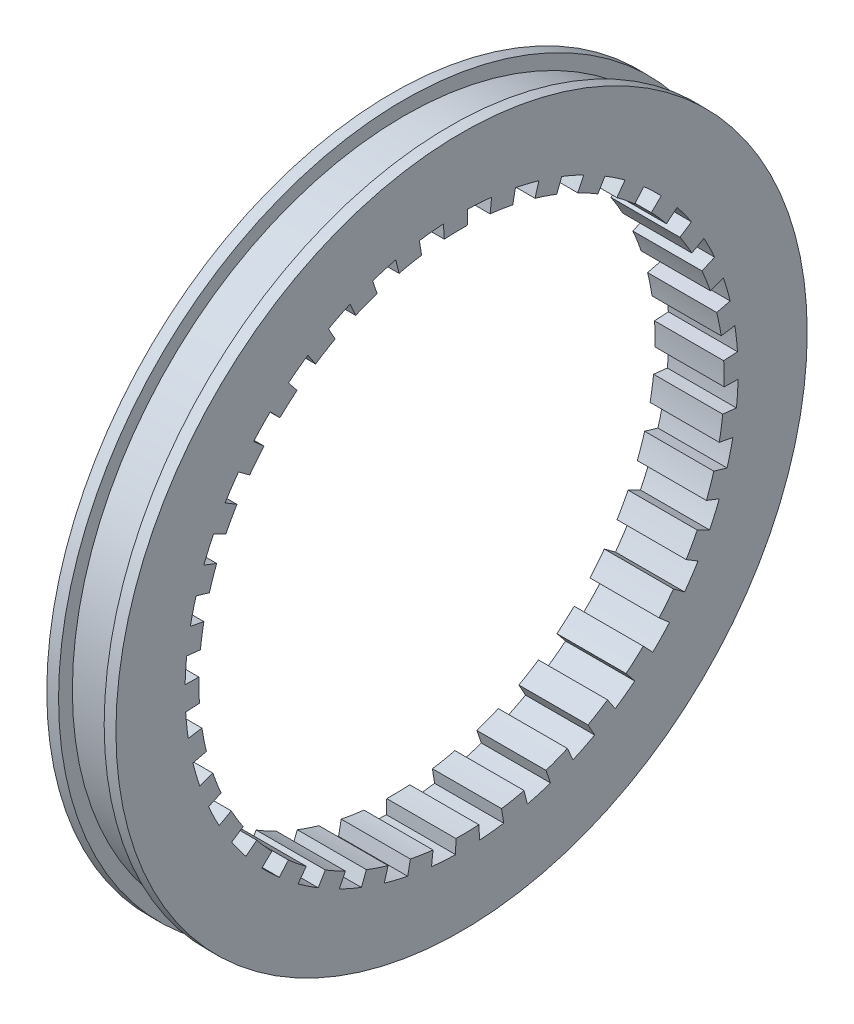
from build123d import *

# Parameters (mm, degrees)
SKETCH1_R               = 20
BOSS_EXTRUDE1_DEPTH     = 4
CUT_EXTRUDE1_DEPTH      = 29.565713714
CIRPATTERN2_COUNT       = 36
SKETCH5_R               = 25
BOSS_EXTRUDE2_DEPTH     = 5
CUT_EXTRUDE2_DEPTH      = 37.482872694
CUT_EXTRUDE2_DEPTH_BACK = 37.482872694
SKETCH7_W               = 3.3
SKETCH7_H               = 2
SCALE1_SCALE            = 1.9329
SCALE2_SCALE            = 1.5


with BuildPart() as part:
    # Sketch1 → Boss-Extrude1 (new body)
    with BuildSketch(Plane(origin=(0, 0, 0), x_dir=(0, 0, -1), z_dir=(1, 0, 0))):
        Circle(SKETCH1_R)
    extrude(amount=BOSS_EXTRUDE1_DEPTH)

    # Sketch2 → Cut-Extrude1 (cut, through all)
    with BuildSketch(Plane(origin=(4, 0, 0), x_dir=(0, 0, -1), z_dir=(1, 0, 0))):
        with BuildLine():
            Line((-17.042306621, 8.399987204), (-17.939270128, 8.842091794))
            ThreePointArc((-17.939270128, 8.842091794), (-17.53650929, 9.616176054), (-17.100366711, 10.371955377))
            Line((-17.100366711, 10.371955377), (-16.245348375, 9.853357608))
            ThreePointArc((-16.245348375, 9.853357608), (-16.659683826, 9.135367252), (-17.042306621, 8.399987204))
        make_face()
    cut_extrude1 = extrude(amount=-CUT_EXTRUDE1_DEPTH, mode=Mode.SUBTRACT)

    # CirPattern2: Cut-Extrude1 ×36 about axis
    cirpattern2_axis = Axis((0, 0, 0), (1, 0, 0))
    for i in range(1, CIRPATTERN2_COUNT):
        add(cut_extrude1.rotate(cirpattern2_axis, i * 360 / CIRPATTERN2_COUNT), mode=Mode.SUBTRACT)

    # Sketch6 → Cut-Extrude2 (cut, two sides: drawn at the far end of the back side and taken through both)
    with BuildSketch(Plane(origin=(9, 0, 0), x_dir=(0, 0, -1), z_dir=(1, 0, 0)).offset(-CUT_EXTRUDE2_DEPTH_BACK)):
        with BuildLine():
            Line((-10.559076871, 15.795755621), (-11.114817759, 16.62711118))
            ThreePointArc((-11.114817759, 16.62711118), (-11.829503319, 16.126464313), (-12.521670746, 15.595119805))
            Line((-12.521670746, 15.595119805), (-11.895587209, 14.815363814))
            ThreePointArc((-11.895587209, 14.815363814), (-12.530502339, 14.282384644), (-13.141564946, 13.722218144))
            Line((-13.141564946, 13.722218144), (-13.833226259, 14.444440151))
            ThreePointArc((-13.833226259, 14.444440151), (-14.450117723, 13.82729539), (-15.039502566, 13.183829586))
            Line((-15.039502566, 13.183829586), (-14.287527438, 12.524638107))
            ThreePointArc((-14.287527438, 12.524638107), (-14.820245919, 11.889504233), (-15.324753219, 11.231738012))
            Line((-15.324753219, 11.231738012), (-16.131319178, 11.822882118))
            ThreePointArc((-16.131319178, 11.822882118), (-16.631672612, 11.107991094), (-17.100366711, 10.371955377))
            Line((-17.100366711, 10.371955377), (-16.245348375, 9.853357608))
            ThreePointArc((-16.245348375, 9.853357608), (-16.659683826, 9.135367252), (-17.042306621, 8.399987204))
            Line((-17.042306621, 8.399987204), (-17.939270128, 8.842091794))
            ThreePointArc((-17.939270128, 8.842091794), (-18.307882545, 8.051176109), (-18.641644866, 7.244934553))
            Line((-18.641644866, 7.244934553), (-17.709562623, 6.882687825))
            ThreePointArc((-17.709562623, 6.882687825), (-17.99292567, 6.103656759), (-18.24203816, 5.313007036))
            Line((-18.24203816, 5.313007036), (-19.202145432, 5.592638985))
            ThreePointArc((-19.202145432, 5.592638985), (-19.42781673, 4.749730212), (-19.616506076, 3.897780058))
            Line((-19.616506076, 3.897780058), (-18.635680772, 3.702891055))
            ThreePointArc((-18.635680772, 3.702891055), (-18.779461573, 2.886489745), (-18.887494601, 2.064593837))
            Line((-18.887494601, 2.064593837), (-19.881573264, 2.173256671))
            ThreePointArc((-19.881573264, 2.173256671), (-19.957446536, 1.303966166), (-19.995329674, 0.432193488))
            Line((-19.995329674, 0.432193488), (-18.995563191, 0.410583814))
            ThreePointArc((-18.995563191, 0.410583814), (-18.995393038, -0.4183818), (-18.959064075, -1.246551))
            Line((-18.959064075, -1.246551), (-19.956909553, -1.312158948))
            ThreePointArc((-19.956909553, -1.312158948), (-19.880679427, -2.181418232), (-19.766605299, -3.046525062))
            Line((-19.766605299, -3.046525062), (-18.778275034, -2.894198809))
            ThreePointArc((-18.778275034, -2.894198809), (-18.634159098, -3.710541026), (-18.454571981, -4.519820017))
            Line((-18.454571981, -4.519820017), (-19.425865244, -4.757705281))
            ThreePointArc((-19.425865244, -4.757705281), (-19.199847935, -5.60052134), (-18.937282624, -6.43267649))
            Line((-18.937282624, -6.43267649), (-17.990418493, -6.111042665))
            ThreePointArc((-17.990418493, -6.111042665), (-17.706735664, -6.88995734), (-17.389347057, -7.655756589))
            Line((-17.389347057, -7.655756589), (-18.304575849, -8.058691146))
            ThreePointArc((-18.304575849, -8.058691146), (-17.935638778, -8.849455442), (-17.532560199, -9.623374297))
            Line((-17.532560199, -9.623374297), (-16.655932189, -9.142205582))
            ThreePointArc((-16.655932189, -9.142205582), (-16.241302026, -9.860025786), (-15.795755621, -10.559076871))
            Line((-15.795755621, -10.559076871), (-16.62711118, -11.114817759))
            ThreePointArc((-16.62711118, -11.114817759), (-16.126464313, -11.829503319), (-15.595119805, -12.521670746))
            Line((-15.595119805, -12.521670746), (-14.815363814, -11.895587209))
            ThreePointArc((-14.815363814, -11.895587209), (-14.282384644, -12.530502339), (-13.722218144, -13.141564946))
            Line((-13.722218144, -13.141564946), (-14.444440151, -13.833226259))
            ThreePointArc((-14.444440151, -13.833226259), (-13.82729539, -14.450117723), (-13.183829586, -15.039502566))
            Line((-13.183829586, -15.039502566), (-12.524638107, -14.287527438))
            ThreePointArc((-12.524638107, -14.287527438), (-11.889504233, -14.820245919), (-11.231738012, -15.324753219))
            Line((-11.231738012, -15.324753219), (-11.822882118, -16.131319178))
            ThreePointArc((-11.822882118, -16.131319178), (-11.107991094, -16.631672612), (-10.371955377, -17.100366711))
            Line((-10.371955377, -17.100366711), (-9.853357608, -16.245348375))
            ThreePointArc((-9.853357608, -16.245348375), (-9.135367252, -16.659683826), (-8.399987204, -17.042306621))
            Line((-8.399987204, -17.042306621), (-8.842091794, -17.939270128))
            ThreePointArc((-8.842091794, -17.939270128), (-8.051176109, -18.307882545), (-7.244934553, -18.641644866))
            Line((-7.244934553, -18.641644866), (-6.882687825, -17.709562623))
            ThreePointArc((-6.882687825, -17.709562623), (-6.103656759, -17.99292567), (-5.313007036, -18.24203816))
            Line((-5.313007036, -18.24203816), (-5.592638985, -19.202145432))
            ThreePointArc((-5.592638985, -19.202145432), (-4.749730212, -19.42781673), (-3.897780058, -19.616506076))
            Line((-3.897780058, -19.616506076), (-3.702891055, -18.635680772))
            ThreePointArc((-3.702891055, -18.635680772), (-2.886489745, -18.779461573), (-2.064593837, -18.887494601))
            Line((-2.064593837, -18.887494601), (-2.173256671, -19.881573264))
            ThreePointArc((-2.173256671, -19.881573264), (-1.303966166, -19.957446536), (-0.432193488, -19.995329674))
            Line((-0.432193488, -19.995329674), (-0.410583814, -18.995563191))
            ThreePointArc((-0.410583814, -18.995563191), (0.4183818, -18.995393038), (1.246551, -18.959064075))
            Line((1.246551, -18.959064075), (1.312158948, -19.956909553))
            ThreePointArc((1.312158948, -19.956909553), (2.181418232, -19.880679427), (3.046525062, -19.766605299))
            Line((3.046525062, -19.766605299), (2.894198809, -18.778275034))
            ThreePointArc((2.894198809, -18.778275034), (3.710541026, -18.634159098), (4.519820017, -18.454571981))
            Line((4.519820017, -18.454571981), (4.757705281, -19.425865244))
            ThreePointArc((4.757705281, -19.425865244), (5.60052134, -19.199847935), (6.43267649, -18.937282624))
            Line((6.43267649, -18.937282624), (6.111042665, -17.990418493))
            ThreePointArc((6.111042665, -17.990418493), (6.88995734, -17.706735664), (7.655756589, -17.389347057))
            Line((7.655756589, -17.389347057), (8.058691146, -18.304575849))
            ThreePointArc((8.058691146, -18.304575849), (8.849455442, -17.935638778), (9.623374297, -17.532560199))
            Line((9.623374297, -17.532560199), (9.142205582, -16.655932189))
            ThreePointArc((9.142205582, -16.655932189), (9.860025786, -16.241302026), (10.559076871, -15.795755621))
            Line((10.559076871, -15.795755621), (11.114817759, -16.62711118))
            ThreePointArc((11.114817759, -16.62711118), (11.829503319, -16.126464313), (12.521670746, -15.595119805))
            Line((12.521670746, -15.595119805), (11.895587209, -14.815363814))
            ThreePointArc((11.895587209, -14.815363814), (12.530502339, -14.282384644), (13.141564946, -13.722218144))
            Line((13.141564946, -13.722218144), (13.833226259, -14.444440151))
            ThreePointArc((13.833226259, -14.444440151), (14.450117723, -13.82729539), (15.039502566, -13.183829586))
            Line((15.039502566, -13.183829586), (14.287527438, -12.524638107))
            ThreePointArc((14.287527438, -12.524638107), (14.820245919, -11.889504233), (15.324753219, -11.231738012))
            Line((15.324753219, -11.231738012), (16.131319178, -11.822882118))
            ThreePointArc((16.131319178, -11.822882118), (16.631672612, -11.107991094), (17.100366711, -10.371955377))
            Line((17.100366711, -10.371955377), (16.245348375, -9.853357608))
            ThreePointArc((16.245348375, -9.853357608), (16.659683826, -9.135367252), (17.042306621, -8.399987204))
            Line((17.042306621, -8.399987204), (17.939270128, -8.842091794))
            ThreePointArc((17.939270128, -8.842091794), (18.307882545, -8.051176109), (18.641644866, -7.244934553))
            Line((18.641644866, -7.244934553), (17.709562623, -6.882687825))
            ThreePointArc((17.709562623, -6.882687825), (17.99292567, -6.103656759), (18.24203816, -5.313007036))
            Line((18.24203816, -5.313007036), (19.202145432, -5.592638985))
            ThreePointArc((19.202145432, -5.592638985), (19.42781673, -4.749730212), (19.616506076, -3.897780058))
            Line((19.616506076, -3.897780058), (18.635680772, -3.702891055))
            ThreePointArc((18.635680772, -3.702891055), (18.779461573, -2.886489745), (18.887494601, -2.064593837))
            Line((18.887494601, -2.064593837), (19.881573264, -2.173256671))
            ThreePointArc((19.881573264, -2.173256671), (19.957446536, -1.303966166), (19.995329674, -0.432193488))
            Line((19.995329674, -0.432193488), (18.995563191, -0.410583814))
            ThreePointArc((18.995563191, -0.410583814), (18.995393038, 0.4183818), (18.959064075, 1.246551))
            Line((18.959064075, 1.246551), (19.956909553, 1.312158948))
            ThreePointArc((19.956909553, 1.312158948), (19.880679427, 2.181418232), (19.766605299, 3.046525062))
            Line((19.766605299, 3.046525062), (18.778275034, 2.894198809))
            ThreePointArc((18.778275034, 2.894198809), (18.634159098, 3.710541026), (18.454571981, 4.519820017))
            Line((18.454571981, 4.519820017), (19.425865244, 4.757705281))
            ThreePointArc((19.425865244, 4.757705281), (19.199847935, 5.60052134), (18.937282624, 6.43267649))
            Line((18.937282624, 6.43267649), (17.990418493, 6.111042665))
            ThreePointArc((17.990418493, 6.111042665), (17.706735664, 6.88995734), (17.389347057, 7.655756589))
            Line((17.389347057, 7.655756589), (18.304575849, 8.058691146))
            ThreePointArc((18.304575849, 8.058691146), (17.935638778, 8.849455442), (17.532560199, 9.623374297))
            Line((17.532560199, 9.623374297), (16.655932189, 9.142205582))
            ThreePointArc((16.655932189, 9.142205582), (16.241302026, 9.860025786), (15.795755621, 10.559076871))
            Line((15.795755621, 10.559076871), (16.62711118, 11.114817759))
            ThreePointArc((16.62711118, 11.114817759), (16.126464313, 11.829503319), (15.595119805, 12.521670746))
            Line((15.595119805, 12.521670746), (14.815363814, 11.895587209))
            ThreePointArc((14.815363814, 11.895587209), (14.282384644, 12.530502339), (13.722218144, 13.141564946))
            Line((13.722218144, 13.141564946), (14.444440151, 13.833226259))
            ThreePointArc((14.444440151, 13.833226259), (13.82729539, 14.450117723), (13.183829586, 15.039502566))
            Line((13.183829586, 15.039502566), (12.524638107, 14.287527438))
            ThreePointArc((12.524638107, 14.287527438), (11.889504233, 14.820245919), (11.231738012, 15.324753219))
            Line((11.231738012, 15.324753219), (11.822882118, 16.131319178))
            ThreePointArc((11.822882118, 16.131319178), (11.107991094, 16.631672612), (10.371955377, 17.100366711))
            Line((10.371955377, 17.100366711), (9.853357608, 16.245348375))
            ThreePointArc((9.853357608, 16.245348375), (9.135367252, 16.659683826), (8.399987204, 17.042306621))
            Line((8.399987204, 17.042306621), (8.842091794, 17.939270128))
            ThreePointArc((8.842091794, 17.939270128), (8.051176109, 18.307882545), (7.244934553, 18.641644866))
            Line((7.244934553, 18.641644866), (6.882687825, 17.709562623))
            ThreePointArc((6.882687825, 17.709562623), (6.103656759, 17.99292567), (5.313007036, 18.24203816))
            Line((5.313007036, 18.24203816), (5.592638985, 19.202145432))
            ThreePointArc((5.592638985, 19.202145432), (4.749730212, 19.42781673), (3.897780058, 19.616506076))
            Line((3.897780058, 19.616506076), (3.702891055, 18.635680772))
            ThreePointArc((3.702891055, 18.635680772), (2.886489745, 18.779461573), (2.064593837, 18.887494601))
            Line((2.064593837, 18.887494601), (2.173256671, 19.881573264))
            ThreePointArc((2.173256671, 19.881573264), (1.303966166, 19.957446536), (0.432193488, 19.995329674))
            Line((0.432193488, 19.995329674), (0.410583814, 18.995563191))
            ThreePointArc((0.410583814, 18.995563191), (-0.4183818, 18.995393038), (-1.246551, 18.959064075))
            Line((-1.246551, 18.959064075), (-1.312158948, 19.956909553))
            ThreePointArc((-1.312158948, 19.956909553), (-2.181418232, 19.880679427), (-3.046525062, 19.766605299))
            Line((-3.046525062, 19.766605299), (-2.894198809, 18.778275034))
            ThreePointArc((-2.894198809, 18.778275034), (-3.710541026, 18.634159098), (-4.519820017, 18.454571981))
            Line((-4.519820017, 18.454571981), (-4.757705281, 19.425865244))
            ThreePointArc((-4.757705281, 19.425865244), (-5.60052134, 19.199847935), (-6.43267649, 18.937282624))
            Line((-6.43267649, 18.937282624), (-6.111042665, 17.990418493))
            ThreePointArc((-6.111042665, 17.990418493), (-6.88995734, 17.706735664), (-7.655756589, 17.389347057))
            Line((-7.655756589, 17.389347057), (-8.058691146, 18.304575849))
            ThreePointArc((-8.058691146, 18.304575849), (-8.849455442, 17.935638778), (-9.623374297, 17.532560199))
            Line((-9.623374297, 17.532560199), (-9.142205582, 16.655932189))
            ThreePointArc((-9.142205582, 16.655932189), (-9.860025786, 16.241302026), (-10.559076871, 15.795755621))
        make_face()
    extrude(amount=CUT_EXTRUDE2_DEPTH + CUT_EXTRUDE2_DEPTH_BACK, mode=Mode.SUBTRACT)


with BuildPart() as body_2:
    # Sketch5 → Boss-Extrude2 (new body)
    with BuildSketch(Plane(origin=(4, 0, 0), x_dir=(0, 0, -1), z_dir=(1, 0, 0))):
        Circle(SKETCH5_R)
        with BuildLine():
            Line((-10.559076871, 15.795755621), (-11.114817759, 16.62711118))
            ThreePointArc((-11.114817759, 16.62711118), (-11.829503319, 16.126464313), (-12.521670746, 15.595119805))
            Line((-12.521670746, 15.595119805), (-11.895587209, 14.815363814))
            ThreePointArc((-11.895587209, 14.815363814), (-12.530502339, 14.282384644), (-13.141564946, 13.722218144))
            Line((-13.141564946, 13.722218144), (-13.833226259, 14.444440151))
            ThreePointArc((-13.833226259, 14.444440151), (-14.450117723, 13.82729539), (-15.039502566, 13.183829586))
            Line((-15.039502566, 13.183829586), (-14.287527438, 12.524638107))
            ThreePointArc((-14.287527438, 12.524638107), (-14.820245919, 11.889504233), (-15.324753219, 11.231738012))
            Line((-15.324753219, 11.231738012), (-16.131319178, 11.822882118))
            ThreePointArc((-16.131319178, 11.822882118), (-16.631672612, 11.107991094), (-17.100366711, 10.371955377))
            Line((-17.100366711, 10.371955377), (-16.245348375, 9.853357608))
            ThreePointArc((-16.245348375, 9.853357608), (-16.659683826, 9.135367252), (-17.042306621, 8.399987204))
            Line((-17.042306621, 8.399987204), (-17.939270128, 8.842091794))
            ThreePointArc((-17.939270128, 8.842091794), (-18.307882545, 8.051176109), (-18.641644866, 7.244934553))
            Line((-18.641644866, 7.244934553), (-17.709562623, 6.882687825))
            ThreePointArc((-17.709562623, 6.882687825), (-17.99292567, 6.103656759), (-18.24203816, 5.313007036))
            Line((-18.24203816, 5.313007036), (-19.202145432, 5.592638985))
            ThreePointArc((-19.202145432, 5.592638985), (-19.42781673, 4.749730212), (-19.616506076, 3.897780058))
            Line((-19.616506076, 3.897780058), (-18.635680772, 3.702891055))
            ThreePointArc((-18.635680772, 3.702891055), (-18.779461573, 2.886489745), (-18.887494601, 2.064593837))
            Line((-18.887494601, 2.064593837), (-19.881573264, 2.173256671))
            ThreePointArc((-19.881573264, 2.173256671), (-19.957446536, 1.303966166), (-19.995329674, 0.432193488))
            Line((-19.995329674, 0.432193488), (-18.995563191, 0.410583814))
            ThreePointArc((-18.995563191, 0.410583814), (-18.995393038, -0.4183818), (-18.959064075, -1.246551))
            Line((-18.959064075, -1.246551), (-19.956909553, -1.312158948))
            ThreePointArc((-19.956909553, -1.312158948), (-19.880679427, -2.181418232), (-19.766605299, -3.046525062))
            Line((-19.766605299, -3.046525062), (-18.778275034, -2.894198809))
            ThreePointArc((-18.778275034, -2.894198809), (-18.634159098, -3.710541026), (-18.454571981, -4.519820017))
            Line((-18.454571981, -4.519820017), (-19.425865244, -4.757705281))
            ThreePointArc((-19.425865244, -4.757705281), (-19.199847935, -5.60052134), (-18.937282624, -6.43267649))
            Line((-18.937282624, -6.43267649), (-17.990418493, -6.111042665))
            ThreePointArc((-17.990418493, -6.111042665), (-17.706735664, -6.88995734), (-17.389347057, -7.655756589))
            Line((-17.389347057, -7.655756589), (-18.304575849, -8.058691146))
            ThreePointArc((-18.304575849, -8.058691146), (-17.935638778, -8.849455442), (-17.532560199, -9.623374297))
            Line((-17.532560199, -9.623374297), (-16.655932189, -9.142205582))
            ThreePointArc((-16.655932189, -9.142205582), (-16.241302026, -9.860025786), (-15.795755621, -10.559076871))
            Line((-15.795755621, -10.559076871), (-16.62711118, -11.114817759))
            ThreePointArc((-16.62711118, -11.114817759), (-16.126464313, -11.829503319), (-15.595119805, -12.521670746))
            Line((-15.595119805, -12.521670746), (-14.815363814, -11.895587209))
            ThreePointArc((-14.815363814, -11.895587209), (-14.282384644, -12.530502339), (-13.722218144, -13.141564946))
            Line((-13.722218144, -13.141564946), (-14.444440151, -13.833226259))
            ThreePointArc((-14.444440151, -13.833226259), (-13.82729539, -14.450117723), (-13.183829586, -15.039502566))
            Line((-13.183829586, -15.039502566), (-12.524638107, -14.287527438))
            ThreePointArc((-12.524638107, -14.287527438), (-11.889504233, -14.820245919), (-11.231738012, -15.324753219))
            Line((-11.231738012, -15.324753219), (-11.822882118, -16.131319178))
            ThreePointArc((-11.822882118, -16.131319178), (-11.107991094, -16.631672612), (-10.371955377, -17.100366711))
            Line((-10.371955377, -17.100366711), (-9.853357608, -16.245348375))
            ThreePointArc((-9.853357608, -16.245348375), (-9.135367252, -16.659683826), (-8.399987204, -17.042306621))
            Line((-8.399987204, -17.042306621), (-8.842091794, -17.939270128))
            ThreePointArc((-8.842091794, -17.939270128), (-8.051176109, -18.307882545), (-7.244934553, -18.641644866))
            Line((-7.244934553, -18.641644866), (-6.882687825, -17.709562623))
            ThreePointArc((-6.882687825, -17.709562623), (-6.103656759, -17.99292567), (-5.313007036, -18.24203816))
            Line((-5.313007036, -18.24203816), (-5.592638985, -19.202145432))
            ThreePointArc((-5.592638985, -19.202145432), (-4.749730212, -19.42781673), (-3.897780058, -19.616506076))
            Line((-3.897780058, -19.616506076), (-3.702891055, -18.635680772))
            ThreePointArc((-3.702891055, -18.635680772), (-2.886489745, -18.779461573), (-2.064593837, -18.887494601))
            Line((-2.064593837, -18.887494601), (-2.173256671, -19.881573264))
            ThreePointArc((-2.173256671, -19.881573264), (-1.303966166, -19.957446536), (-0.432193488, -19.995329674))
            Line((-0.432193488, -19.995329674), (-0.410583814, -18.995563191))
            ThreePointArc((-0.410583814, -18.995563191), (0.4183818, -18.995393038), (1.246551, -18.959064075))
            Line((1.246551, -18.959064075), (1.312158948, -19.956909553))
            ThreePointArc((1.312158948, -19.956909553), (2.181418232, -19.880679427), (3.046525062, -19.766605299))
            Line((3.046525062, -19.766605299), (2.894198809, -18.778275034))
            ThreePointArc((2.894198809, -18.778275034), (3.710541026, -18.634159098), (4.519820017, -18.454571981))
            Line((4.519820017, -18.454571981), (4.757705281, -19.425865244))
            ThreePointArc((4.757705281, -19.425865244), (5.60052134, -19.199847935), (6.43267649, -18.937282624))
            Line((6.43267649, -18.937282624), (6.111042665, -17.990418493))
            ThreePointArc((6.111042665, -17.990418493), (6.88995734, -17.706735664), (7.655756589, -17.389347057))
            Line((7.655756589, -17.389347057), (8.058691146, -18.304575849))
            ThreePointArc((8.058691146, -18.304575849), (8.849455442, -17.935638778), (9.623374297, -17.532560199))
            Line((9.623374297, -17.532560199), (9.142205582, -16.655932189))
            ThreePointArc((9.142205582, -16.655932189), (9.860025786, -16.241302026), (10.559076871, -15.795755621))
            Line((10.559076871, -15.795755621), (11.114817759, -16.62711118))
            ThreePointArc((11.114817759, -16.62711118), (11.829503319, -16.126464313), (12.521670746, -15.595119805))
            Line((12.521670746, -15.595119805), (11.895587209, -14.815363814))
            ThreePointArc((11.895587209, -14.815363814), (12.530502339, -14.282384644), (13.141564946, -13.722218144))
            Line((13.141564946, -13.722218144), (13.833226259, -14.444440151))
            ThreePointArc((13.833226259, -14.444440151), (14.450117723, -13.82729539), (15.039502566, -13.183829586))
            Line((15.039502566, -13.183829586), (14.287527438, -12.524638107))
            ThreePointArc((14.287527438, -12.524638107), (14.820245919, -11.889504233), (15.324753219, -11.231738012))
            Line((15.324753219, -11.231738012), (16.131319178, -11.822882118))
            ThreePointArc((16.131319178, -11.822882118), (16.631672612, -11.107991094), (17.100366711, -10.371955377))
            Line((17.100366711, -10.371955377), (16.245348375, -9.853357608))
            ThreePointArc((16.245348375, -9.853357608), (16.659683826, -9.135367252), (17.042306621, -8.399987204))
            Line((17.042306621, -8.399987204), (17.939270128, -8.842091794))
            ThreePointArc((17.939270128, -8.842091794), (18.307882545, -8.051176109), (18.641644866, -7.244934553))
            Line((18.641644866, -7.244934553), (17.709562623, -6.882687825))
            ThreePointArc((17.709562623, -6.882687825), (17.99292567, -6.103656759), (18.24203816, -5.313007036))
            Line((18.24203816, -5.313007036), (19.202145432, -5.592638985))
            ThreePointArc((19.202145432, -5.592638985), (19.42781673, -4.749730212), (19.616506076, -3.897780058))
            Line((19.616506076, -3.897780058), (18.635680772, -3.702891055))
            ThreePointArc((18.635680772, -3.702891055), (18.779461573, -2.886489745), (18.887494601, -2.064593837))
            Line((18.887494601, -2.064593837), (19.881573264, -2.173256671))
            ThreePointArc((19.881573264, -2.173256671), (19.957446536, -1.303966166), (19.995329674, -0.432193488))
            Line((19.995329674, -0.432193488), (18.995563191, -0.410583814))
            ThreePointArc((18.995563191, -0.410583814), (18.995393038, 0.4183818), (18.959064075, 1.246551))
            Line((18.959064075, 1.246551), (19.956909553, 1.312158948))
            ThreePointArc((19.956909553, 1.312158948), (19.880679427, 2.181418232), (19.766605299, 3.046525062))
            Line((19.766605299, 3.046525062), (18.778275034, 2.894198809))
            ThreePointArc((18.778275034, 2.894198809), (18.634159098, 3.710541026), (18.454571981, 4.519820017))
            Line((18.454571981, 4.519820017), (19.425865244, 4.757705281))
            ThreePointArc((19.425865244, 4.757705281), (19.199847935, 5.60052134), (18.937282624, 6.43267649))
            Line((18.937282624, 6.43267649), (17.990418493, 6.111042665))
            ThreePointArc((17.990418493, 6.111042665), (17.706735664, 6.88995734), (17.389347057, 7.655756589))
            Line((17.389347057, 7.655756589), (18.304575849, 8.058691146))
            ThreePointArc((18.304575849, 8.058691146), (17.935638778, 8.849455442), (17.532560199, 9.623374297))
            Line((17.532560199, 9.623374297), (16.655932189, 9.142205582))
            ThreePointArc((16.655932189, 9.142205582), (16.241302026, 9.860025786), (15.795755621, 10.559076871))
            Line((15.795755621, 10.559076871), (16.62711118, 11.114817759))
            ThreePointArc((16.62711118, 11.114817759), (16.126464313, 11.829503319), (15.595119805, 12.521670746))
            Line((15.595119805, 12.521670746), (14.815363814, 11.895587209))
            ThreePointArc((14.815363814, 11.895587209), (14.282384644, 12.530502339), (13.722218144, 13.141564946))
            Line((13.722218144, 13.141564946), (14.444440151, 13.833226259))
            ThreePointArc((14.444440151, 13.833226259), (13.82729539, 14.450117723), (13.183829586, 15.039502566))
            Line((13.183829586, 15.039502566), (12.524638107, 14.287527438))
            ThreePointArc((12.524638107, 14.287527438), (11.889504233, 14.820245919), (11.231738012, 15.324753219))
            Line((11.231738012, 15.324753219), (11.822882118, 16.131319178))
            ThreePointArc((11.822882118, 16.131319178), (11.107991094, 16.631672612), (10.371955377, 17.100366711))
            Line((10.371955377, 17.100366711), (9.853357608, 16.245348375))
            ThreePointArc((9.853357608, 16.245348375), (9.135367252, 16.659683826), (8.399987204, 17.042306621))
            Line((8.399987204, 17.042306621), (8.842091794, 17.939270128))
            ThreePointArc((8.842091794, 17.939270128), (8.051176109, 18.307882545), (7.244934553, 18.641644866))
            Line((7.244934553, 18.641644866), (6.882687825, 17.709562623))
            ThreePointArc((6.882687825, 17.709562623), (6.103656759, 17.99292567), (5.313007036, 18.24203816))
            Line((5.313007036, 18.24203816), (5.592638985, 19.202145432))
            ThreePointArc((5.592638985, 19.202145432), (4.749730212, 19.42781673), (3.897780058, 19.616506076))
            Line((3.897780058, 19.616506076), (3.702891055, 18.635680772))
            ThreePointArc((3.702891055, 18.635680772), (2.886489745, 18.779461573), (2.064593837, 18.887494601))
            Line((2.064593837, 18.887494601), (2.173256671, 19.881573264))
            ThreePointArc((2.173256671, 19.881573264), (1.303966166, 19.957446536), (0.432193488, 19.995329674))
            Line((0.432193488, 19.995329674), (0.410583814, 18.995563191))
            ThreePointArc((0.410583814, 18.995563191), (-0.4183818, 18.995393038), (-1.246551, 18.959064075))
            Line((-1.246551, 18.959064075), (-1.312158948, 19.956909553))
            ThreePointArc((-1.312158948, 19.956909553), (-2.181418232, 19.880679427), (-3.046525062, 19.766605299))
            Line((-3.046525062, 19.766605299), (-2.894198809, 18.778275034))
            ThreePointArc((-2.894198809, 18.778275034), (-3.710541026, 18.634159098), (-4.519820017, 18.454571981))
            Line((-4.519820017, 18.454571981), (-4.757705281, 19.425865244))
            ThreePointArc((-4.757705281, 19.425865244), (-5.60052134, 19.199847935), (-6.43267649, 18.937282624))
            Line((-6.43267649, 18.937282624), (-6.111042665, 17.990418493))
            ThreePointArc((-6.111042665, 17.990418493), (-6.88995734, 17.706735664), (-7.655756589, 17.389347057))
            Line((-7.655756589, 17.389347057), (-8.058691146, 18.304575849))
            ThreePointArc((-8.058691146, 18.304575849), (-8.849455442, 17.935638778), (-9.623374297, 17.532560199))
            Line((-9.623374297, 17.532560199), (-9.142205582, 16.655932189))
            ThreePointArc((-9.142205582, 16.655932189), (-9.860025786, 16.241302026), (-10.559076871, 15.795755621))
        make_face(mode=Mode.SUBTRACT)
    extrude(amount=BOSS_EXTRUDE2_DEPTH)

    # Sketch7 → Cut-Revolve1 (revolve, cut)
    with BuildSketch(Plane(origin=(0, 0, 0), x_dir=(1, 0, 0), z_dir=(0, 1, 0)), mode=Mode.PRIVATE) as cut_revolve1_sk:
        with Locations((6.5, 25)):
            Rectangle(SKETCH7_W, SKETCH7_H)
    revolve(cut_revolve1_sk.sketch.rotate(Axis((4, 0, 0), (1, 0, 0)), 180), axis=Axis((4, 0, 0), (1, 0, 0)), mode=Mode.SUBTRACT)


with BuildPart() as body_2_1:
    # Scale1: scaled about (6.5, 0, 0)
    add(body_2.part.scale(SCALE1_SCALE).moved(Location((-6.06385, 0, 0))))


with BuildPart() as body_2_2:
    # Scale2: scaled about (6.5, 0, 0)
    add(body_2_1.part.scale(SCALE2_SCALE).moved(Location((-3.25, 0, 0))))


solid = body_2_2.part
